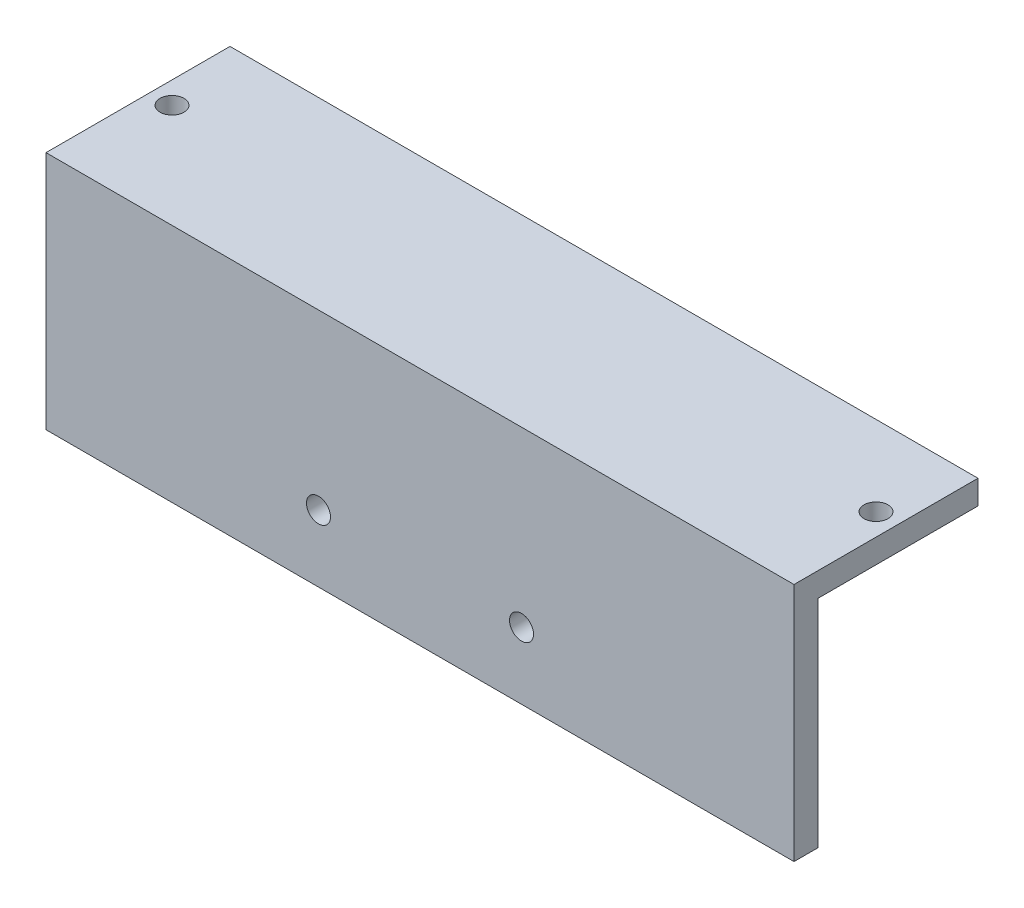
from build123d import *

# Parameters (mm, degrees)
SKETCH_1_W          = 93.5
SKETCH_1_H          = 30
EXTRUDE_1_DEPTH     = 3
SKETCH_2_W          = 93.5
SKETCH_2_H          = 3
EXTRUDE_2_DEPTH     = 20
SKETCH_3_R          = 1.5
CUT_EXTRUDE_1_DEPTH = 20
SKETCH_4_R          = 1.5
CUT_EXTRUDE_2_DEPTH = 20


with BuildPart() as part:
    # 草图1 → 凸台-拉伸1 (new body)
    with BuildSketch(Plane.XY):
        with Locations((28.153508772, -3.684210526)):
            Rectangle(SKETCH_1_W, SKETCH_1_H)
    extrude(amount=EXTRUDE_1_DEPTH)

    # 草图2 → 凸台-拉伸2 (add)
    with BuildSketch(Plane(origin=(0, 0, 0), x_dir=(-1, 0, 0), z_dir=(0, 0, -1))):
        with Locations((-28.153508772, 9.815789474)):
            Rectangle(SKETCH_2_W, SKETCH_2_H)
    extrude(amount=EXTRUDE_2_DEPTH)

    # 草图3 → 切除-拉伸1 (cut)
    with BuildSketch(Plane.XZ.offset(-8.315789474)):
        with Locations((-15.846491228, -10)):
            Circle(SKETCH_3_R)
        with Locations((72.153508772, -10)):
            Circle(SKETCH_3_R)
    extrude(amount=-CUT_EXTRUDE_1_DEPTH, mode=Mode.SUBTRACT)

    # 草图4 → 切除-拉伸2 (cut)
    with BuildSketch(Plane(origin=(0, 0, 0), x_dir=(-1, 0, 0), z_dir=(0, 0, -1))):
        with Locations((-40.843508772, -10.343453639)):
            Circle(SKETCH_4_R)
        with Locations((-15.463508772, -10.343453639)):
            Circle(SKETCH_4_R)
    extrude(amount=-CUT_EXTRUDE_2_DEPTH, mode=Mode.SUBTRACT)


solid = part.part
